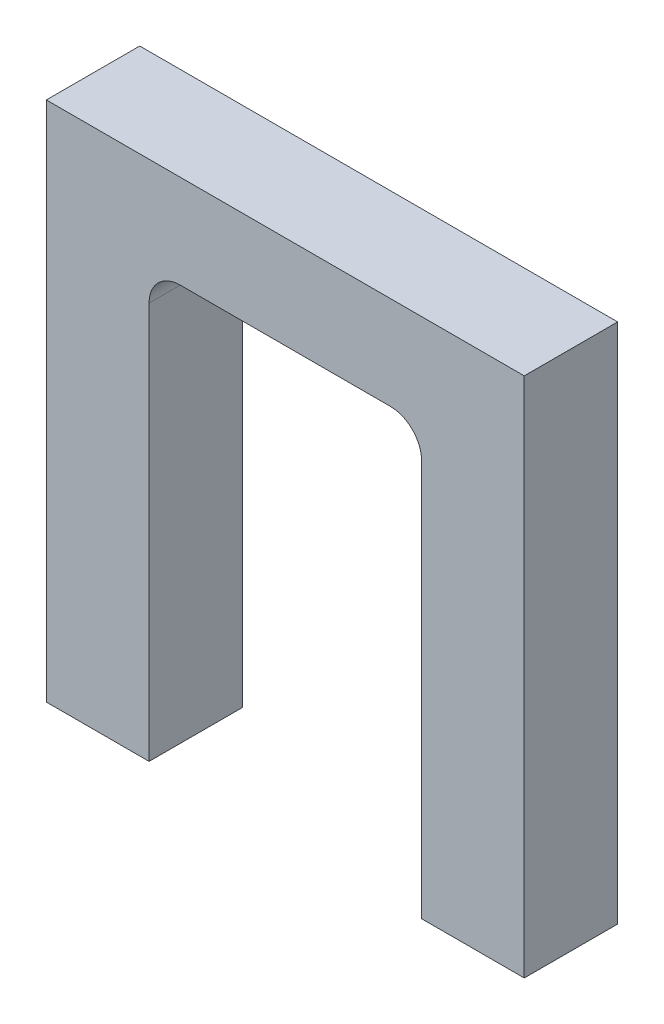
from build123d import *

# Parameters (mm, degrees)
BOSS_EXTRUDE1_DEPTH = 3
SKETCH2_R           = 1.5
CUT_EXTRUDE1_DEPTH  = 12


with BuildPart() as part:
    # Sketch1 → Boss-Extrude1 (new, symmetric)
    with BuildSketch(Plane.XY):
        with BuildLine():
            Line((-6.75, 20.40625), (6.75, 20.40625))
            ThreePointArc((6.75, 20.40625), (8.164213562, 19.820463562), (8.75, 18.40625))
            Line((8.75, 18.40625), (8.75, -7.09375))
            Line((8.75, -7.09375), (15.35, -7.09375))
            Line((15.35, -7.09375), (15.35, 26.40625))
            Line((15.35, 26.40625), (-15.35, 26.40625))
            Line((-15.35, 26.40625), (-15.35, -7.09375))
            Line((-15.35, -7.09375), (-8.75, -7.09375))
            Line((-8.75, -7.09375), (-8.75, 18.40625))
            ThreePointArc((-8.75, 18.40625), (-8.164213562, 19.820463562), (-6.75, 20.40625))
        make_face()
    extrude(amount=BOSS_EXTRUDE1_DEPTH, both=True)

    # Sketch2 → Cut-Extrude1 (cut)
    with BuildSketch(Plane.XZ.offset(7.09375)):
        with Locations((-12.05, 0)):
            Circle(SKETCH2_R)
        with Locations(Location((12.05, 0, 0), (0, 0, 180))):
            Circle(SKETCH2_R)
    extrude(amount=-CUT_EXTRUDE1_DEPTH, mode=Mode.SUBTRACT)


solid = part.part
